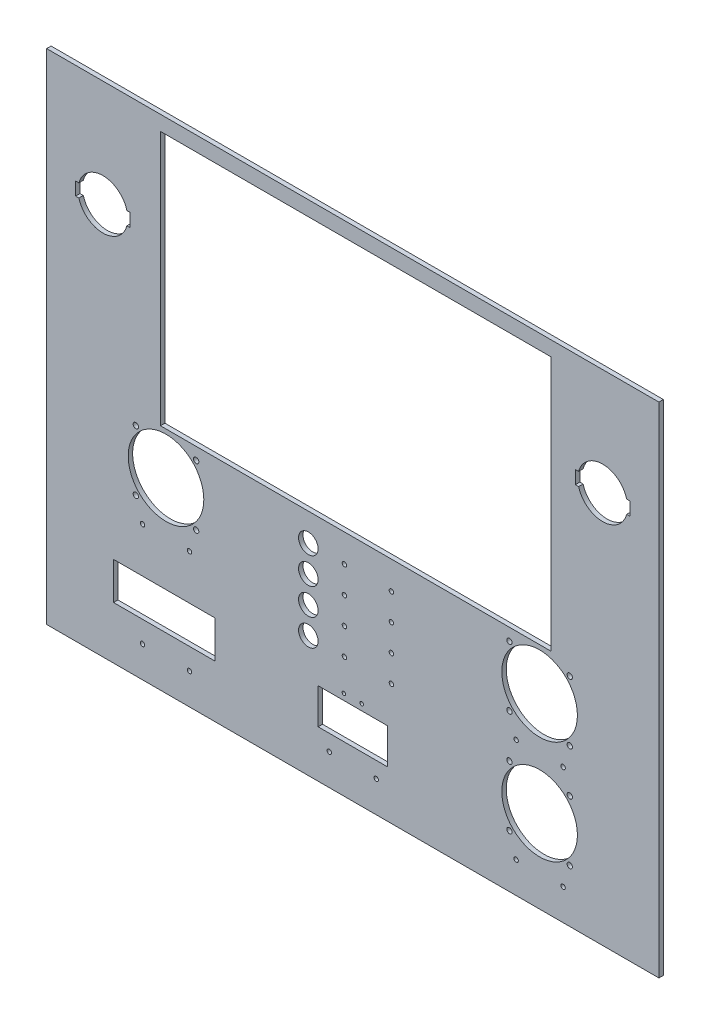
from build123d import *

# Parameters (mm, degrees)
SKETCH1_W           = 874.1918
SKETCH1_H           = 712.1144
BOSS_EXTRUDE1_DEPTH = 6.35
SKETCH2_R           = 53.975
CUT_EXTRUDE1_DEPTH  = 1126.241709767
SKETCH3_R           = 3.81
CUT_EXTRUDE2_DEPTH  = 1126.241709767
SKETCH4_R           = 13.97
CUT_EXTRUDE3_DEPTH  = 1126.241709767
SKETCH5_W           = 99.06
SKETCH5_H           = 50.8
CUT_EXTRUDE4_DEPTH  = 1126.241709767
SKETCH6_R           = 3.175
CUT_EXTRUDE5_DEPTH  = 1126.241709767
CUT_EXTRUDE7_DEPTH  = 1126.241709767
SKETCH9_W           = 144.78
SKETCH9_H           = 53.34
CUT_EXTRUDE8_DEPTH  = 1126.241709767
SKETCH10_W          = 557.53
SKETCH10_H          = 363.982
CUT_EXTRUDE9_DEPTH  = 1126.241709767
SKETCH12_R          = 2.54
CUT_EXTRUDE11_DEPTH = 1126.241709767


with BuildPart() as part:
    # Sketch1 → Boss-Extrude1 (new body)
    with BuildSketch(Plane.XY):
        with Locations((431.8, -358.8893)):
            Rectangle(SKETCH1_W, SKETCH1_H)
    extrude(amount=BOSS_EXTRUDE1_DEPTH)

    # Sketch2 → Cut-Extrude1 (cut, through all)
    with BuildSketch(Plane.XY.offset(6.35)):
        with Locations((165.1381, -448.3735)):
            Circle(SKETCH2_R)
        with Locations((698.5381, -448.3735)):
            Circle(SKETCH2_R)
        with Locations((698.5381, -596.4555)):
            Circle(SKETCH2_R)
    extrude(amount=-CUT_EXTRUDE1_DEPTH, mode=Mode.SUBTRACT)

    # Sketch3 → Cut-Extrude2 (cut, through all)
    with BuildSketch(Plane.XY.offset(6.35)):
        with Locations((122.0851, -405.3205)):
            Circle(SKETCH3_R)
        with Locations((208.1911, -491.4265)):
            Circle(SKETCH3_R)
        with Locations((122.0851, -491.4265)):
            Circle(SKETCH3_R)
        with Locations((741.5911, -405.3205)):
            Circle(SKETCH3_R)
        with Locations((655.4851, -405.3205)):
            Circle(SKETCH3_R)
        with Locations((655.4851, -491.4265)):
            Circle(SKETCH3_R)
        with Locations((741.5911, -491.4265)):
            Circle(SKETCH3_R)
        with Locations((741.5911, -553.4025)):
            Circle(SKETCH3_R)
        with Locations((655.4851, -553.4025)):
            Circle(SKETCH3_R)
        with Locations((655.4851, -639.5085)):
            Circle(SKETCH3_R)
        with Locations((741.5911, -639.5085)):
            Circle(SKETCH3_R)
        with Locations((208.1911, -405.3205)):
            Circle(SKETCH3_R)
    extrude(amount=-CUT_EXTRUDE2_DEPTH, mode=Mode.SUBTRACT)

    # Sketch4 → Cut-Extrude3 (cut, through all)
    with BuildSketch(Plane.XY.offset(6.35)):
        with Locations((368.3381, -427.6725)):
            Circle(SKETCH4_R)
        with Locations((368.3381, -465.7725)):
            Circle(SKETCH4_R)
        with Locations((368.3381, -503.8725)):
            Circle(SKETCH4_R)
        with Locations((368.3381, -541.9725)):
            Circle(SKETCH4_R)
    extrude(amount=-CUT_EXTRUDE3_DEPTH, mode=Mode.SUBTRACT)

    # Sketch5 → Cut-Extrude4 (cut, through all)
    with BuildSketch(Plane.XY.offset(6.35)):
        with Locations((431.8381, -622.2365)):
            Rectangle(SKETCH5_W, SKETCH5_H)
    extrude(amount=-CUT_EXTRUDE4_DEPTH, mode=Mode.SUBTRACT)

    # Sketch6 → Cut-Extrude5 (cut, through all)
    with BuildSketch(Plane.XY.offset(6.35)):
        with Locations((131.6101, -522.4145)):
            Circle(SKETCH6_R)
        with Locations((198.6661, -522.4145)):
            Circle(SKETCH6_R)
        with Locations((131.6101, -670.4965)):
            Circle(SKETCH6_R)
        with Locations((198.6661, -670.4965)):
            Circle(SKETCH6_R)
        with Locations((398.3101, -670.4965)):
            Circle(SKETCH6_R)
        with Locations((465.3661, -670.4965)):
            Circle(SKETCH6_R)
        with Locations((419.9001, -427.9265)):
            Circle(SKETCH6_R)
        with Locations((486.9561, -427.9265)):
            Circle(SKETCH6_R)
        with Locations((419.9001, -466.0265)):
            Circle(SKETCH6_R)
        with Locations((486.9561, -466.0265)):
            Circle(SKETCH6_R)
        with Locations((419.9001, -504.1265)):
            Circle(SKETCH6_R)
        with Locations((486.9561, -504.1265)):
            Circle(SKETCH6_R)
        with Locations((419.9001, -542.2265)):
            Circle(SKETCH6_R)
        with Locations((486.9561, -542.2265)):
            Circle(SKETCH6_R)
        with Locations((665.0101, -522.4145)):
            Circle(SKETCH6_R)
        with Locations((732.0661, -522.4145)):
            Circle(SKETCH6_R)
        with Locations((665.0101, -670.4965)):
            Circle(SKETCH6_R)
        with Locations((732.0661, -670.4965)):
            Circle(SKETCH6_R)
    extrude(amount=-CUT_EXTRUDE5_DEPTH, mode=Mode.SUBTRACT)

    # Sketch8 → Cut-Extrude7 (cut, through all)
    with BuildSketch(Plane(origin=(0, 0, 0), x_dir=(-1, 0, 0), z_dir=(0, 0, -1))):
        with BuildLine():
            Line((-109.32724398, -145.8341), (-114.0206, -145.8341))
            Line((-114.0206, -145.8341), (-114.0206, -164.6301))
            Line((-114.0206, -164.6301), (-109.32724398, -164.6301))
            ThreePointArc((-109.32724398, -164.6301), (-75.0316, -190.7921), (-40.73595602, -164.6301))
            Line((-40.73595602, -164.6301), (-36.0426, -164.6301))
            Line((-36.0426, -164.6301), (-36.0426, -145.8341))
            Line((-36.0426, -145.8341), (-40.73595602, -145.8341))
            ThreePointArc((-40.73595602, -145.8341), (-75.0316, -119.6721), (-109.32724398, -145.8341))
        make_face()
        with BuildLine():
            Line((-749.5794, -164.6301), (-754.27275602, -164.6301))
            ThreePointArc((-754.27275602, -164.6301), (-788.5684, -190.7921), (-822.86404398, -164.6301))
            Line((-822.86404398, -164.6301), (-827.5574, -164.6301))
            Line((-827.5574, -164.6301), (-827.5574, -145.8341))
            Line((-827.5574, -145.8341), (-822.86404398, -145.8341))
            ThreePointArc((-822.86404398, -145.8341), (-788.5684, -119.6721), (-754.27275602, -145.8341))
            Line((-754.27275602, -145.8341), (-749.5794, -145.8341))
            Line((-749.5794, -145.8341), (-749.5794, -164.6301))
        make_face()
    extrude(amount=-CUT_EXTRUDE7_DEPTH, mode=Mode.SUBTRACT)

    # Sketch9 → Cut-Extrude8 (cut, through all)
    with BuildSketch(Plane.XY.offset(6.35)):
        with Locations((162.5981, -613.3465)):
            Rectangle(SKETCH9_W, SKETCH9_H)
    extrude(amount=-CUT_EXTRUDE8_DEPTH, mode=Mode.SUBTRACT)

    # Sketch10 → Cut-Extrude9 (cut, through all)
    with BuildSketch(Plane.XY.offset(6.35)):
        with Locations((436.0291, -205.946512668)):
            Rectangle(SKETCH10_W, SKETCH10_H)
    extrude(amount=-CUT_EXTRUDE9_DEPTH, mode=Mode.SUBTRACT)

    # Sketch12 → Cut-Extrude11 (cut, through all)
    with BuildSketch(Plane(origin=(0, 0, 0), x_dir=(-1, 0, 0), z_dir=(0, 0, -1))):
        with Locations((-444.5381, -587.9465)):
            Circle(SKETCH12_R)
        with Locations((-419.1381, -587.9465)):
            Circle(SKETCH12_R)
    extrude(amount=-CUT_EXTRUDE11_DEPTH, mode=Mode.SUBTRACT)


solid = part.part
